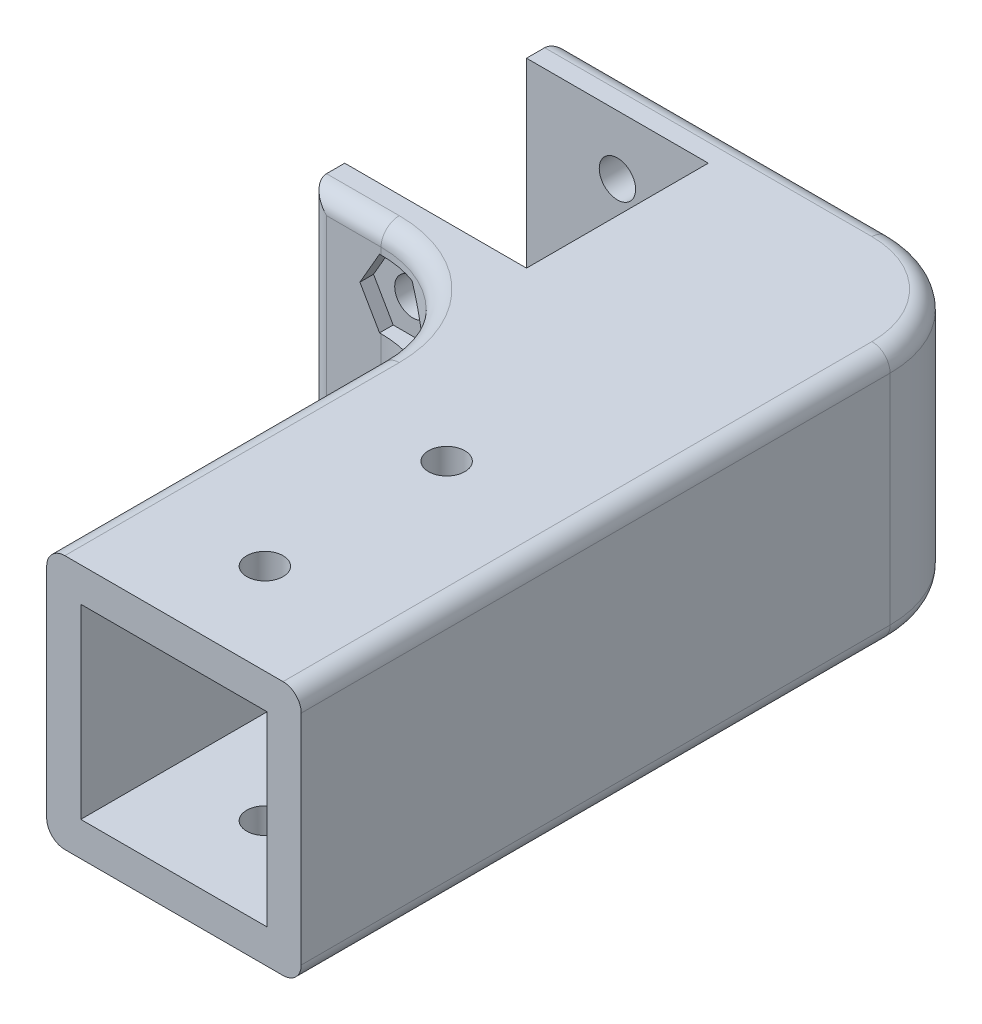
from build123d import *

# Parameters (mm, degrees)
SKETCH_1_W          = 28
SKETCH_1_H          = 28
SKETCH_1_W_2        = 20.5
SKETCH_1_H_2        = 20.5
EXTRUDE_1_DEPTH     = 50
SKETCH_2_W          = 28
SKETCH_2_H          = 28
EXTRUDE_2_DEPTH     = 10
SKETCH_7_W          = 28
SKETCH_7_H          = 28
EXTRUDE_4_DEPTH     = 48
SKETCH_8_W          = 20
SKETCH_8_H          = 28
CUT_EXTRUDE_4_DEPTH = 20
FILLET_4_R          = 12
FILLET_6_R          = 2
SKETCH_9_R          = 2
CUT_EXTRUDE_5_DEPTH = 86.134031464
CUT_EXTRUDE_START   = -26.5
CUT_EXTRUDE_6_DEPTH = 59.634031464
SKETCH_12_R         = 2
CUT_EXTRUDE_7_DEPTH = 67.633324996


with BuildPart() as part:
    # 草图1 → 凸台-拉伸1 (new body)
    with BuildSketch(Plane.XY):
        Rectangle(SKETCH_1_W, SKETCH_1_H)
        Rectangle(SKETCH_1_W_2, SKETCH_1_H_2, mode=Mode.SUBTRACT)
    extrude(amount=EXTRUDE_1_DEPTH)

    # 草图2 → 凸台-拉伸2 (add)
    with BuildSketch(Plane(origin=(0, 0, 0), x_dir=(-1, 0, 0), z_dir=(0, 0, -1))):
        Rectangle(SKETCH_2_W, SKETCH_2_H)
    extrude(amount=-EXTRUDE_2_DEPTH)

    # 草图7 → 凸台-拉伸4 (add)
    with BuildSketch(Plane(origin=(14, 0, 0), x_dir=(0, 0, -1), z_dir=(1, 0, 0))):
        with Locations((12.784134516, 0)):
            Rectangle(SKETCH_7_W, SKETCH_7_H)
    extrude(amount=-EXTRUDE_4_DEPTH)

    # 草图8 → 切除-拉伸4 (cut)
    with BuildSketch(Plane.ZY.offset(34)):
        with Locations((-12.784134516, 0)):
            Rectangle(SKETCH_8_W, SKETCH_8_H)
    extrude(amount=-CUT_EXTRUDE_4_DEPTH, mode=Mode.SUBTRACT)

    # 圆角4
    fillet_4_edges = [part.edges().sort_by_distance(p)[0] for p in [
        (-14, 0, 1.215865484),
        (14, 0, -26.784134516),
    ]]
    fillet(fillet_4_edges, radius=FILLET_4_R)

    # 圆角6
    fillet_6_edges = [part.edges().sort_by_distance(p)[0] for p in [
        (-34, 0, 1.215865484),
        (-30, -14, 1.215865484),
        (-30, 14, 1.215865484),
        (-34, 0, -26.784134516),
        (-16, 14, -26.784134516),
        (-16, -14, -26.784134516),
        (14, -14, 17.607932742),
        (-14, -14, 31.607932742),
        (-14, 14, 31.607932742),
        (14, 14, 17.607932742),
        (10.485281374, 14, -23.26941589),
        (10.485281374, -14, -23.26941589),
        (-17.514718626, -14, 4.73058411),
        (-17.514718626, 14, 4.73058411),
    ]]
    fillet(fillet_6_edges, radius=FILLET_6_R)

    # 草图9 → 切除-拉伸5 (cut, through all)
    with BuildSketch(Plane(origin=(0, 0, -26.784134516), x_dir=(-1, 0, 0), z_dir=(0, 0, -1))):
        with Locations((24, 7.5)):
            Circle(SKETCH_9_R)
        with Locations((24, -7.5)):
            Circle(SKETCH_9_R)
    extrude(amount=-CUT_EXTRUDE_5_DEPTH, mode=Mode.SUBTRACT)

    # 草图10 → 切除-拉伸6 (cut, through all)
    with BuildSketch(Plane(origin=(0, 0, -26.784134516), x_dir=(-1, 0, 0), z_dir=(0, 0, -1)).offset(CUT_EXTRUDE_START)):
        Polygon((19.669872981, 7.5), (21.834936491, 3.75), (26.165063509, 3.75), (28.330127019, 7.5), (26.165063509, 11.25), (21.834936491, 11.25), align=None)
        Polygon((19.669872981, -7.5), (21.834936491, -11.25), (26.165063509, -11.25), (28.330127019, -7.5), (26.165063509, -3.75), (21.834936491, -3.75), align=None)
    extrude(amount=-CUT_EXTRUDE_6_DEPTH, mode=Mode.SUBTRACT)

    # 草图12 → 切除-拉伸7 (cut, through all)
    with BuildSketch(Plane(origin=(0, 14, 0), x_dir=(1, 0, 0), z_dir=(0, 1, 0))):
        with Locations(Location((0, -40, 0), (0, 0, 270))):
            Circle(SKETCH_12_R)
        with Locations(Location((0, -20, 0), (0, 0, 270))):
            Circle(SKETCH_12_R)
    extrude(amount=-CUT_EXTRUDE_7_DEPTH, mode=Mode.SUBTRACT)


solid = part.part
